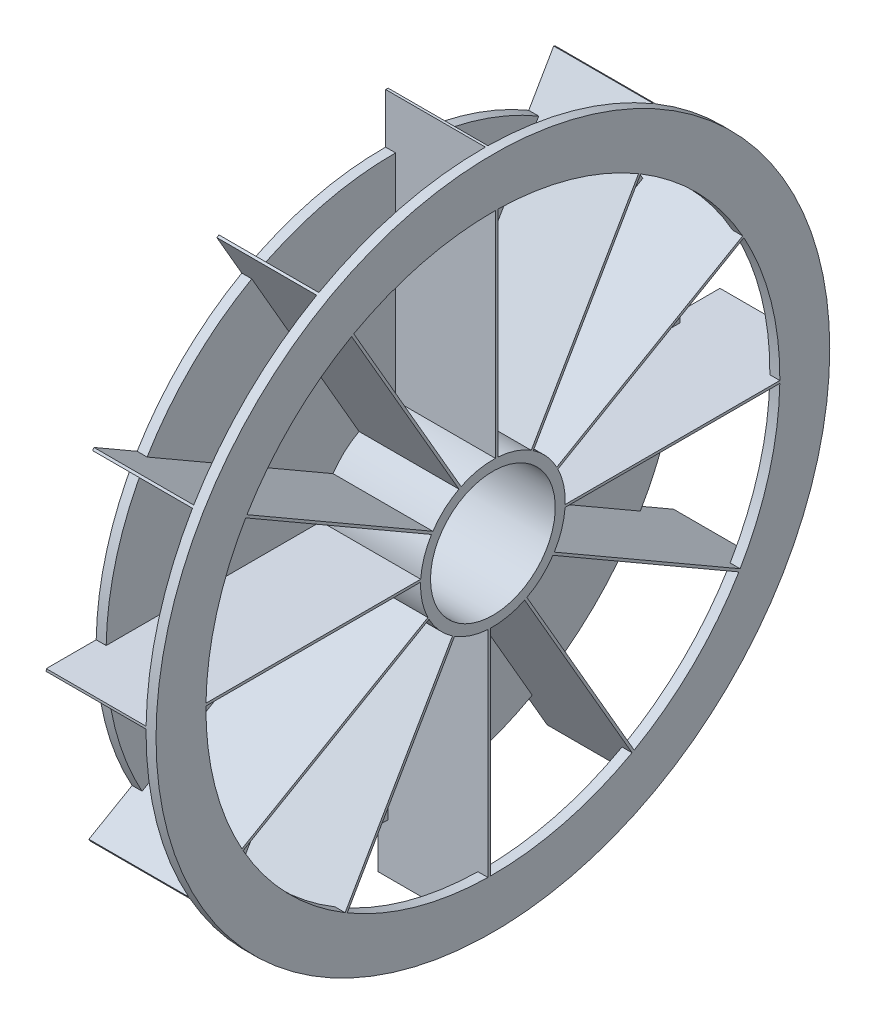
from build123d import *

# Parameters (mm, degrees)
ESBO_O1_W             = 22
ESBO_O1_H             = 55
CORTE_EXTRUS_O1_DEPTH = 20
CIRPATTERN1_COUNT     = 12
CORTE_EXTRUS_O2_DEPTH = 98.532046016
CIRPATTERN2_COUNT     = 12


with BuildPart() as part:
    # Esboço1 → Revolução1 (revolve)
    with BuildSketch(Plane.XY, mode=Mode.PRIVATE) as revolu_o1_sk:
        with Locations((11, 40)):
            Rectangle(ESBO_O1_W, ESBO_O1_H)
    revolve(revolu_o1_sk.sketch.rotate(Axis((0, 0, 0), (1, 0, 0)), 90), axis=Axis((0, 0, 0), (1, 0, 0)))

    # Esboço2 → Corte-extrusão1 (cut)
    with BuildSketch(Plane(origin=(22, 0, 0), x_dir=(0, 0, -1), z_dir=(1, 0, 0))):
        with BuildLine():
            Line((1, 57.49130369), (1, 14.465476141))
            ThreePointArc((1, 14.465476141), (4.473814272, 13.792569951), (7.681217142, 12.298329286))
            Line((7.681217142, 12.298329286), (29.184480159, 49.543073359))
            ThreePointArc((29.184480159, 49.543073359), (15.606706954, 55.34149165), (1, 57.49130369))
        make_face()
    corte_extrus_o1 = extrude(amount=-CORTE_EXTRUS_O1_DEPTH, mode=Mode.SUBTRACT)

    # CirPattern1: Corte-extrusão1 ×12 about axis
    cirpattern1_axis = Axis((0, 0, 0), (1, 0, 0))
    for i in range(1, CIRPATTERN1_COUNT):
        add(corte_extrus_o1.rotate(cirpattern1_axis, i * 360 / CIRPATTERN1_COUNT), mode=Mode.SUBTRACT)

    # Esboço3 → Corte-extrusão2 (cut, through all)
    with BuildSketch(Plane(origin=(20, 0, 0), x_dir=(0, 0, -1), z_dir=(1, 0, 0))):
        with BuildLine():
            Line((29.184480159, 49.543073359), (34.184643112, 58.203609641))
            ThreePointArc((34.184643112, 58.203609641), (18.195083867, 65.001453238), (1, 67.492592186))
            Line((1, 67.492592186), (1, 57.49130369))
            ThreePointArc((1, 57.49130369), (15.606706954, 55.34149165), (29.184480159, 49.543073359))
        make_face()
    corte_extrus_o2 = extrude(amount=-CORTE_EXTRUS_O2_DEPTH, mode=Mode.SUBTRACT)

    # CirPattern2: Corte-extrusão2 ×12 about axis
    cirpattern2_axis = Axis((0, 0, 0), (1, 0, 0))
    for i in range(1, CIRPATTERN2_COUNT):
        add(corte_extrus_o2.rotate(cirpattern2_axis, i * 360 / CIRPATTERN2_COUNT), mode=Mode.SUBTRACT)


solid = part.part
